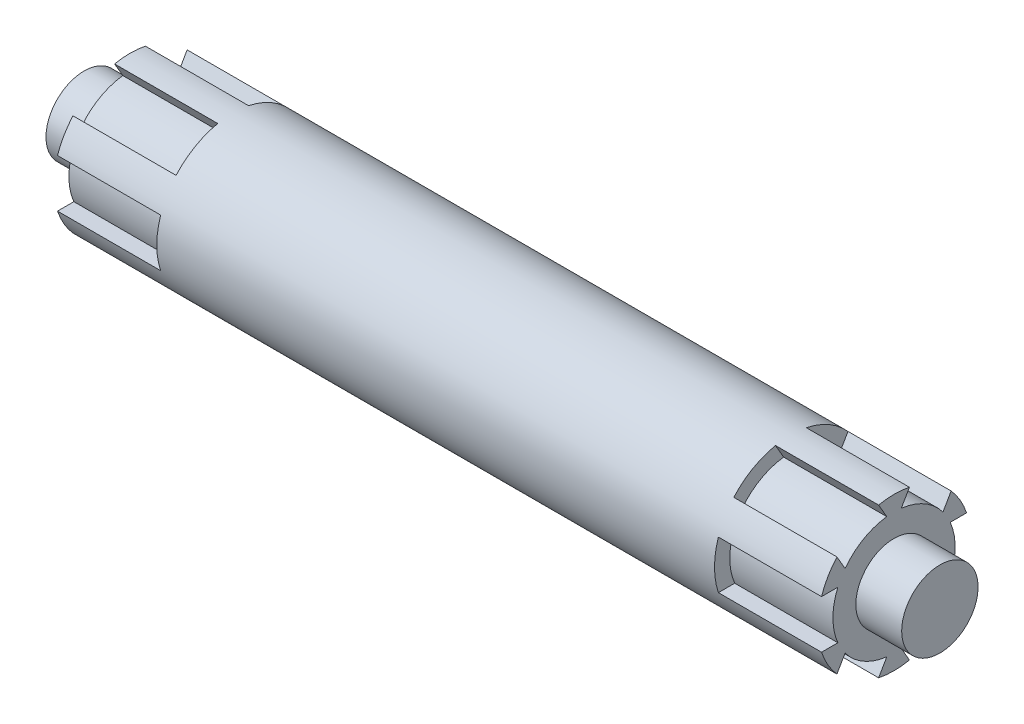
from build123d import *

# Parameters (mm, degrees)
SKETCH2_R           = 10
BOSS_EXTRUDE1_DEPTH = 50
CUT_EXTRUDE3_DEPTH  = 88.648445508
SKETCH5_R           = 5
BOSS_EXTRUDE2_DEPTH = 6


with BuildPart() as part:
    # Sketch2 → Boss-Extrude1 (new, symmetric)
    with BuildSketch(Plane(origin=(0, 0, 0), x_dir=(0, 0, -1), z_dir=(1, 0, 0))):
        Circle(SKETCH2_R)
    extrude(amount=BOSS_EXTRUDE1_DEPTH, both=True)

    # Sketch4 → Cut-Extrude3 (cut, through all)
    with BuildSketch(Plane(origin=(-36.5, 0, 0), x_dir=(0, 0, -1), z_dir=(1, 0, 0))):
        with BuildLine():
            Line((7.353740545, -3.15), (9.49091671, -3.15))
            ThreePointArc((9.49091671, -3.15), (10, 0), (9.49091671, 3.15))
            Line((9.49091671, 3.15), (7.353740545, 3.15))
            ThreePointArc((7.353740545, 3.15), (8, 0), (7.353740545, -3.15))
        make_face()
        with BuildLine():
            Line((-7.473438377, 6.644374976), (-6.404850294, 4.793526125))
            ThreePointArc((-6.404850294, 4.793526125), (-4, 6.92820323), (-0.94889025, 7.943526125))
            Line((-0.94889025, 7.943526125), (-2.017478333, 9.794374976))
            ThreePointArc((-2.017478333, 9.794374976), (-5, 8.660254038), (-7.473438377, 6.644374976))
        make_face()
        with BuildLine():
            Line((-9.49091671, -3.15), (-7.353740545, -3.15))
            ThreePointArc((-7.353740545, -3.15), (-8, 0), (-7.353740545, 3.15))
            Line((-7.353740545, 3.15), (-9.49091671, 3.15))
            ThreePointArc((-9.49091671, 3.15), (-10, 0), (-9.49091671, -3.15))
        make_face()
        with BuildLine():
            Line((-2.017478333, -9.794374976), (-0.94889025, -7.943526125))
            ThreePointArc((-0.94889025, -7.943526125), (-4, -6.92820323), (-6.404850294, -4.793526125))
            Line((-6.404850294, -4.793526125), (-7.473438377, -6.644374976))
            ThreePointArc((-7.473438377, -6.644374976), (-5, -8.660254038), (-2.017478333, -9.794374976))
        make_face()
        with BuildLine():
            Line((0.94889025, -7.943526125), (2.017478333, -9.794374976))
            ThreePointArc((2.017478333, -9.794374976), (5, -8.660254038), (7.473438377, -6.644374976))
            Line((7.473438377, -6.644374976), (6.404850294, -4.793526125))
            ThreePointArc((6.404850294, -4.793526125), (4, -6.92820323), (0.94889025, -7.943526125))
        make_face()
        with BuildLine():
            Line((6.404850294, 4.793526125), (7.473438377, 6.644374976))
            ThreePointArc((7.473438377, 6.644374976), (5, 8.660254038), (2.017478333, 9.794374976))
            Line((2.017478333, 9.794374976), (0.94889025, 7.943526125))
            ThreePointArc((0.94889025, 7.943526125), (4, 6.92820323), (6.404850294, 4.793526125))
        make_face()
    cut_extrude3 = extrude(amount=-CUT_EXTRUDE3_DEPTH, mode=Mode.SUBTRACT)

    # Sketch5 → Boss-Extrude2 (add)
    with BuildSketch(Plane.ZY.offset(50)):
        Circle(SKETCH5_R)
    boss_extrude2 = extrude(amount=BOSS_EXTRUDE2_DEPTH)

    # Mirror3: Cut-Extrude3, Boss-Extrude2 across plane
    add(cut_extrude3.mirror(Plane(origin=(0, 0, 0), x_dir=(0, 0, 1), z_dir=(1, 0, 0))), mode=Mode.SUBTRACT)
    add(boss_extrude2.mirror(Plane(origin=(0, 0, 0), x_dir=(0, 0, 1), z_dir=(1, 0, 0))))


solid = part.part
